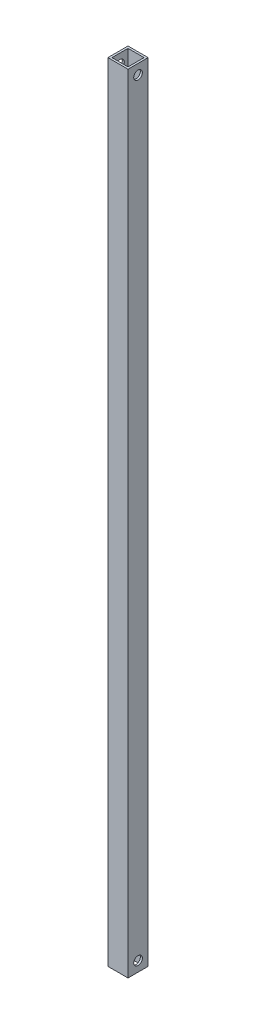
from build123d import *

# Parameters (mm, degrees)
SKETCH_1_W          = 10
SKETCH_1_H          = 10
SKETCH_1_W_2        = 8
SKETCH_1_H_2        = 8
EXTRUDE_1_DEPTH     = 391.837661841
SKETCH_2_R          = 2.15
CUT_EXTRUDE_1_DEPTH = 392.99713422


with BuildPart() as part:
    # ｽｹｯﾁ1 → 押し出し-薄板1 (new body)
    with BuildSketch(Plane(origin=(0, 0, 0), x_dir=(1, 0, 0), z_dir=(0, 1, 0))):
        Rectangle(SKETCH_1_W, SKETCH_1_H)
        Rectangle(SKETCH_1_W_2, SKETCH_1_H_2, mode=Mode.SUBTRACT)
    extrude(amount=EXTRUDE_1_DEPTH)

    # ｽｹｯﾁ2 → ｶｯﾄ - 押し出し1 (cut, through all)
    with BuildSketch(Plane(origin=(5, 0, 0), x_dir=(0, 0, -1), z_dir=(1, 0, 0))):
        with Locations((0, 5)):
            Circle(SKETCH_2_R)
        with Locations((0, 386.837661841)):
            Circle(SKETCH_2_R)
    extrude(amount=-CUT_EXTRUDE_1_DEPTH, mode=Mode.SUBTRACT)


solid = part.part
